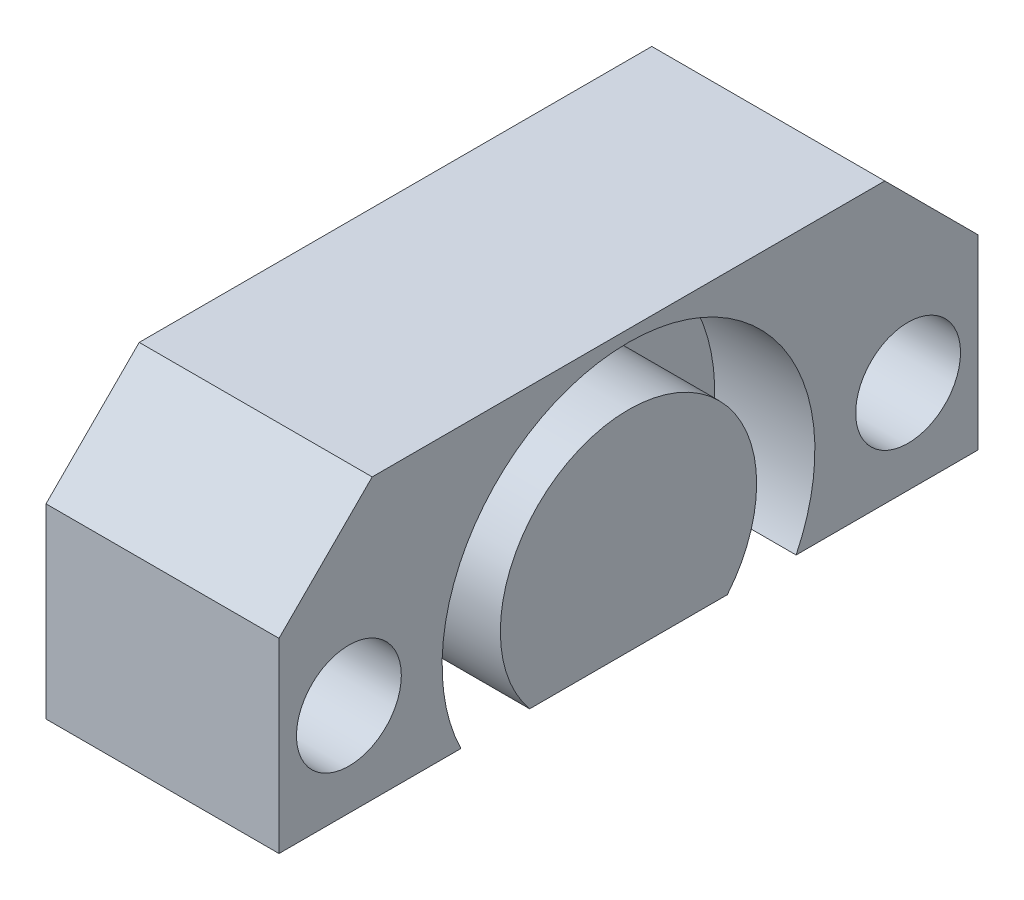
from build123d import *

# Parameters (mm, degrees)
BOSS_EXTRUDE1_DEPTH = 10
SKETCH2_R           = 8
SKETCH2_R_2         = 5.5
CUT_EXTRUDE2_DEPTH  = 4.3
SKETCH3_R           = 2.25
CUT_EXTRUDE3_DEPTH  = 22.656407828


with BuildPart() as part:
    # Sketch1 → Boss-Extrude1 (new body)
    with BuildSketch(Plane(origin=(0, 0, 0), x_dir=(0, 0, -1), z_dir=(1, 0, 0))):
        Polygon((-15, 0), (15, 0), (15, 8), (11, 12), (-11, 12), (-15, 8), align=None)
    extrude(amount=BOSS_EXTRUDE1_DEPTH)

    # Sketch2 → Cut-Extrude2 (cut)
    with BuildSketch(Plane(origin=(10, 0, 0), x_dir=(0, 0, -1), z_dir=(1, 0, 0))):
        with Locations((0, 3.5)):
            Circle(SKETCH2_R)
        with Locations((0, 3.5)):
            Circle(SKETCH2_R_2, mode=Mode.SUBTRACT)
    extrude(amount=-CUT_EXTRUDE2_DEPTH, mode=Mode.SUBTRACT)

    # Sketch3 → Cut-Extrude3 (cut, through all)
    with BuildSketch(Plane(origin=(10, 0, 0), x_dir=(0, 0, -1), z_dir=(1, 0, 0))):
        with Locations((-12, 4)):
            Circle(SKETCH3_R)
        with Locations((12, 4)):
            Circle(SKETCH3_R)
    extrude(amount=-CUT_EXTRUDE3_DEPTH, mode=Mode.SUBTRACT)


solid = part.part
